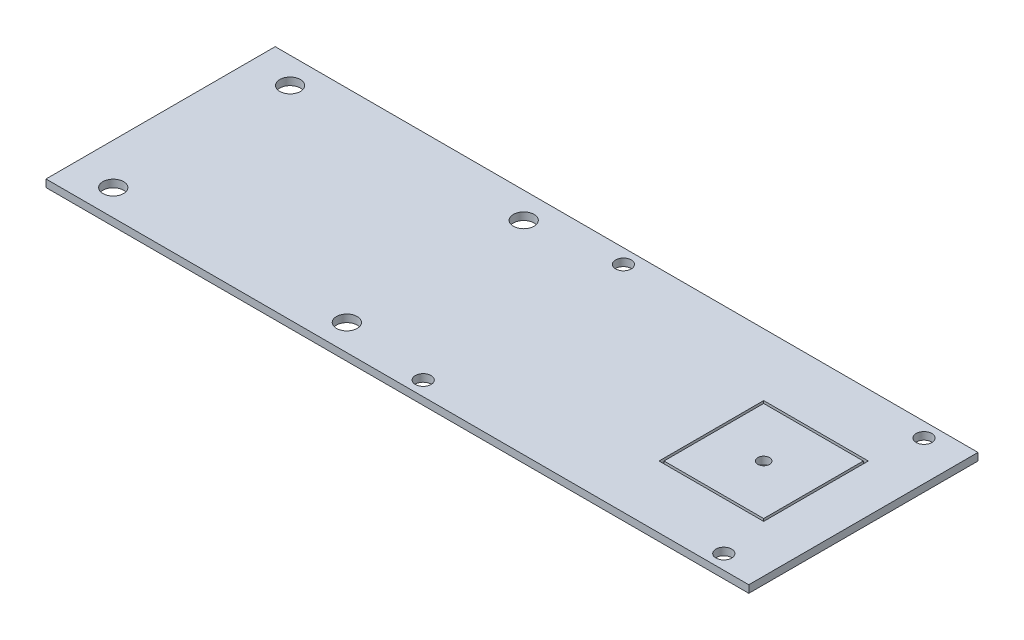
from build123d import *

# Parameters (mm, degrees)
SKETCH1_W               = 141.05
SKETCH1_H               = 46
SKETCH1_R               = 2.075
SKETCH1_R_2             = 1.575
SKETCH1_R_3             = 1.185
BOSS_EXTRUDE1_DEPTH     = 1.5
SKETCH2_W               = 21
SKETCH2_H               = 21
SKETCH2_W_2             = 20
SKETCH2_H_2             = 20
CUT_EXTRUDE_THIN1_DEPTH = 0.75


with BuildPart() as part:
    # Sketch1 → Boss-Extrude1 (new body)
    with BuildSketch(Plane(origin=(0, 0, 0), x_dir=(1, 0, 0), z_dir=(0, 1, 0))):
        Rectangle(SKETCH1_W, SKETCH1_H)
        with Locations((-62.28, -17.75)):
            Circle(SKETCH1_R, mode=Mode.SUBTRACT)
        with Locations((-15.4, -17.75)):
            Circle(SKETCH1_R, mode=Mode.SUBTRACT)
        with Locations((-15.4, 17.75)):
            Circle(SKETCH1_R, mode=Mode.SUBTRACT)
        with Locations((-62.28, 17.75)):
            Circle(SKETCH1_R, mode=Mode.SUBTRACT)
        with Locations((2.27, -20.09)):
            Circle(SKETCH1_R_2, mode=Mode.SUBTRACT)
        with Locations((62.6, -20.09)):
            Circle(SKETCH1_R_2, mode=Mode.SUBTRACT)
        with Locations((62.6, 20.09)):
            Circle(SKETCH1_R_2, mode=Mode.SUBTRACT)
        with Locations((2.27, 20.09)):
            Circle(SKETCH1_R_2, mode=Mode.SUBTRACT)
        with Locations((50.51, 0)):
            Circle(SKETCH1_R_3, mode=Mode.SUBTRACT)
    extrude(amount=BOSS_EXTRUDE1_DEPTH)

    # Sketch2 → Cut-Extrude-Thin1 (cut)
    with BuildSketch(Plane(origin=(0, 1.5, 0), x_dir=(1, 0, 0), z_dir=(0, 1, 0))):
        with Locations((50.51, 0)):
            Rectangle(SKETCH2_W, SKETCH2_H)
        with Locations((50.51, 0)):
            Rectangle(SKETCH2_W_2, SKETCH2_H_2, mode=Mode.SUBTRACT)
    extrude(amount=-CUT_EXTRUDE_THIN1_DEPTH, mode=Mode.SUBTRACT)


solid = part.part
